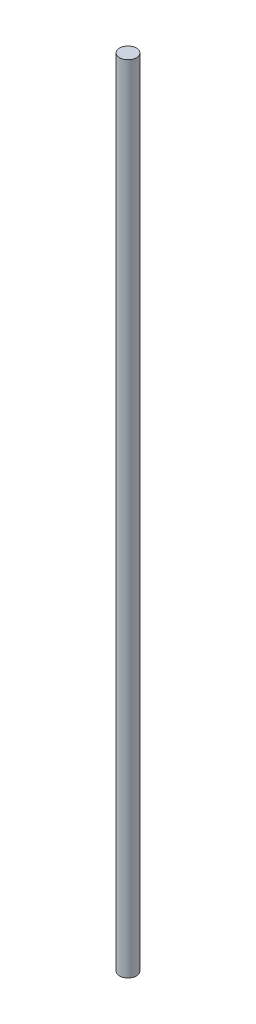
from build123d import *

# Parameters (mm, degrees)
SKETCH1_R           = 3.175
BOSS_EXTRUDE1_DEPTH = 300


with BuildPart() as part:
    # Sketch1 → Boss-Extrude1 (new body)
    with BuildSketch(Plane(origin=(0, 0, 0), x_dir=(1, 0, 0), z_dir=(0, 1, 0))):
        with Locations(Location((0, 0, 0), (0, 0, 270))):
            Circle(SKETCH1_R)
    extrude(amount=BOSS_EXTRUDE1_DEPTH)


solid = part.part
